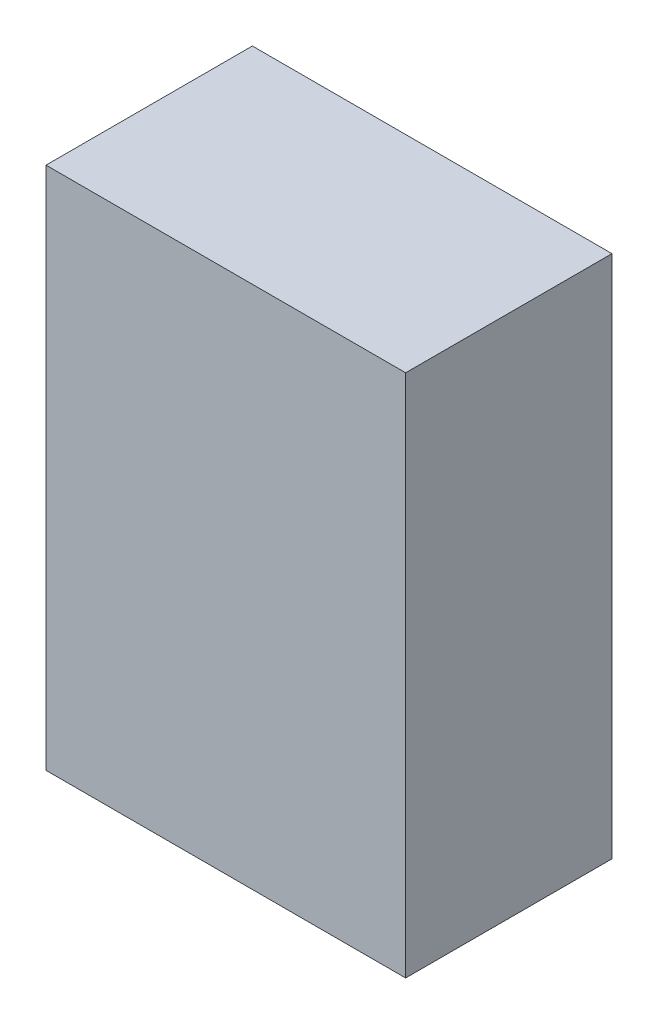
from build123d import *

# Parameters (mm, degrees)
SKETCH1_W           = 43.57
SKETCH1_H           = 63.5
BOSS_EXTRUDE1_DEPTH = 25
CUT_EXTRUDE2_DEPTH  = 81.966628311
SKETCH4_W           = 43.57
SKETCH4_H           = 25
SKETCH4_W_2         = 6
SKETCH4_H_2         = 15
BOSS_EXTRUDE2_DEPTH = 9


with BuildPart() as part:
    # Sketch1 → Boss-Extrude1 (new body)
    with BuildSketch(Plane.XY):
        with Locations((21.785, 31.75)):
            Rectangle(SKETCH1_W, SKETCH1_H)
    extrude(amount=BOSS_EXTRUDE1_DEPTH)

    # Sketch3 → Cut-Extrude2 (cut, through all)
    with BuildSketch(Plane(origin=(43.57, 0, 0), x_dir=(0, 0, -1), z_dir=(1, 0, 0))):
        with BuildLine():
            Line((-14.5, 0), (-14.5, 1.5))
            ThreePointArc((-14.5, 1.5), (-14.060660172, 2.560660172), (-13, 3))
            Line((-13, 3), (-12, 3))
            ThreePointArc((-12, 3), (-10.939339828, 2.560660172), (-10.5, 1.5))
            Line((-10.5, 1.5), (-10.5, 0))
            Line((-10.5, 0), (-7.5, 0))
            Line((-7.5, 0), (-7.5, 3.5))
            ThreePointArc((-7.5, 3.5), (-7.939339828, 4.560660172), (-9, 5))
            Line((-9, 5), (-16, 5))
            ThreePointArc((-16, 5), (-17.060660172, 4.560660172), (-17.5, 3.5))
            Line((-17.5, 3.5), (-17.5, 0))
            Line((-17.5, 0), (-14.5, 0))
        make_face()
    extrude(amount=-CUT_EXTRUDE2_DEPTH, mode=Mode.SUBTRACT)


with BuildPart() as cut_extrude2_piece_1:
    # of the separate pieces the step leaves, piece 1, a body of its own (cut_extrude2_pieces)
    add(part.part.solids().sort_by_distance((0, 0, 0))[0])



with BuildPart() as cut_extrude2_piece_2:
    # of the separate pieces the step leaves, piece 2, a body of its own (cut_extrude2_pieces)
    add(part.part.solids().sort_by_distance((43.57, 0, 10.5))[0])


with BuildPart() as cut_extrude2_piece_1_1:
    add(cut_extrude2_piece_1.part)

    add(cut_extrude2_piece_2.part)  # Boss-Extrude2 merges Cut-Extrude2 piece 2
    # Sketch4 → Boss-Extrude2 (add)
    with BuildSketch(Plane.XZ):
        with Locations((21.785, 12.5)):
            Rectangle(SKETCH4_W, SKETCH4_H)
        with Locations((10.785, 12.5)):
            Rectangle(SKETCH4_W_2, SKETCH4_H_2, mode=Mode.SUBTRACT)
        with Locations((32.785, 12.5)):
            Rectangle(SKETCH4_W_2, SKETCH4_H_2, mode=Mode.SUBTRACT)
    extrude(amount=-BOSS_EXTRUDE2_DEPTH)


solid = cut_extrude2_piece_1_1.part
